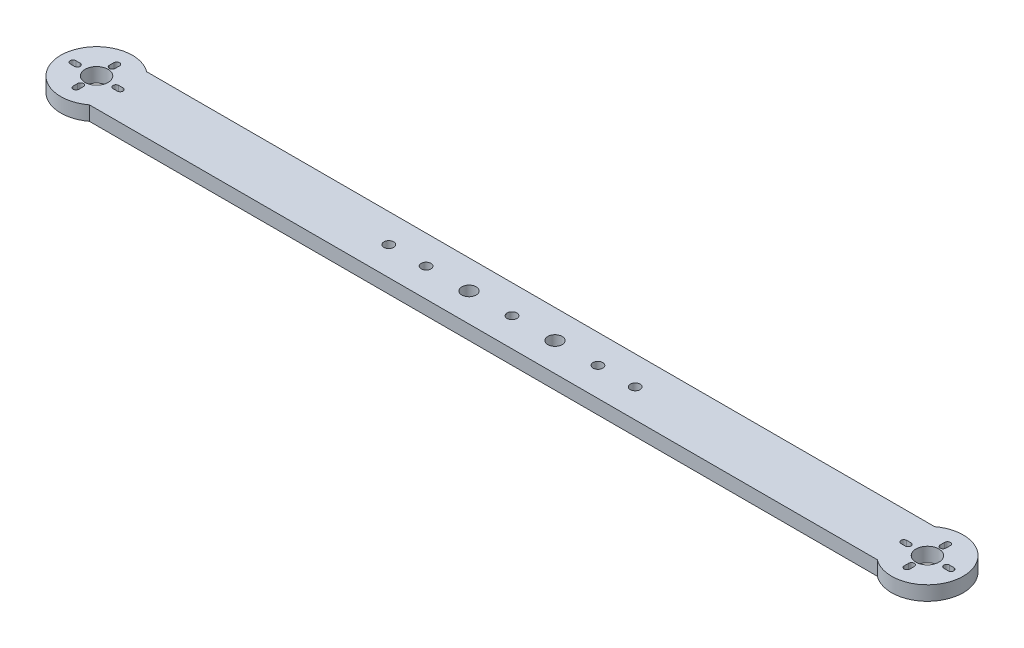
from build123d import *

# Parameters (mm, degrees)
BOSS_EXTRUDE1_DEPTH = 6.35
SKETCH2_R           = 5.08
CUT_EXTRUDE1_DEPTH  = 201.754423986
SKETCH3_R           = 2.159
CUT_EXTRUDE2_DEPTH  = 201.754423986
SKETCH4_R           = 3.175
CUT_EXTRUDE3_DEPTH  = 201.754423986
SKETCH6_R           = 2.159
CUT_EXTRUDE5_DEPTH  = 201.754423986


with BuildPart() as part:
    # Sketch1 → Boss-Extrude1 (new body)
    with BuildSketch(Plane(origin=(0, 0, 0), x_dir=(1, 0, 0), z_dir=(0, 1, 0))):
        with BuildLine():
            Line((-174.625, 12.7), (174.625, 12.7))
            ThreePointArc((174.625, 12.7), (200.025, 0), (174.625, -12.7))
            Line((174.625, -12.7), (-174.625, -12.7))
            ThreePointArc((-174.625, -12.7), (-200.025, 0), (-174.625, 12.7))
        make_face()
    extrude(amount=BOSS_EXTRUDE1_DEPTH)

    # Sketch2 → Cut-Extrude1 (cut, through all)
    with BuildSketch(Plane(origin=(0, 6.35, 0), x_dir=(1, 0, 0), z_dir=(0, 1, 0))):
        with Locations(Location((184.15, 0, 0), (0, 0, 270))):
            Circle(SKETCH2_R)
        with Locations(Location((-184.15, 0, 0), (0, 0, 90))):
            Circle(SKETCH2_R)
        with BuildLine():
            Line((173.691383345, 1.25), (175.608616655, 1.25))
            ThreePointArc((175.608616655, 1.25), (176.858616655, 0), (175.608616655, -1.25))
            Line((175.608616655, -1.25), (173.691383345, -1.25))
            ThreePointArc((173.691383345, -1.25), (172.441383345, 0), (173.691383345, 1.25))
        make_face()
        with BuildLine():
            Line((194.608616655, 1.25), (192.691383345, 1.25))
            ThreePointArc((192.691383345, 1.25), (191.441383345, 0), (192.691383345, -1.25))
            Line((192.691383345, -1.25), (194.608616655, -1.25))
            ThreePointArc((194.608616655, -1.25), (195.858616655, 0), (194.608616655, 1.25))
        make_face()
        with BuildLine():
            Line((185.4, 8.920928665), (185.4, 6.921035691))
            ThreePointArc((185.4, 6.921035691), (184.15, 5.671035691), (182.9, 6.921035691))
            Line((182.9, 6.921035691), (182.9, 8.920928665))
            ThreePointArc((182.9, 8.920928665), (184.15, 10.170928665), (185.4, 8.920928665))
        make_face()
        with BuildLine():
            Line((185.441381345, -9.078964309), (185.441381345, -7.078964309))
            ThreePointArc((185.441381345, -7.078964309), (184.191381345, -5.828964309), (182.941381345, -7.078964309))
            Line((182.941381345, -7.078964309), (182.941381345, -9.078964309))
            ThreePointArc((182.941381345, -9.078964309), (184.191381345, -10.328964309), (185.441381345, -9.078964309))
        make_face()
        with BuildLine():
            Line((-185.441381345, -9.078964309), (-185.441381345, -7.078964309))
            ThreePointArc((-185.441381345, -7.078964309), (-184.191381345, -5.828964309), (-182.941381345, -7.078964309))
            Line((-182.941381345, -7.078964309), (-182.941381345, -9.078964309))
            ThreePointArc((-182.941381345, -9.078964309), (-184.191381345, -10.328964309), (-185.441381345, -9.078964309))
        make_face()
        with BuildLine():
            Line((-185.4, 8.920928665), (-185.4, 6.921035691))
            ThreePointArc((-185.4, 6.921035691), (-184.15, 5.671035691), (-182.9, 6.921035691))
            Line((-182.9, 6.921035691), (-182.9, 8.920928665))
            ThreePointArc((-182.9, 8.920928665), (-184.15, 10.170928665), (-185.4, 8.920928665))
        make_face()
        with BuildLine():
            Line((-194.608616655, 1.25), (-192.691383345, 1.25))
            ThreePointArc((-192.691383345, 1.25), (-191.441383345, 0), (-192.691383345, -1.25))
            Line((-192.691383345, -1.25), (-194.608616655, -1.25))
            ThreePointArc((-194.608616655, -1.25), (-195.858616655, 0), (-194.608616655, 1.25))
        make_face()
        with BuildLine():
            Line((-173.691383345, 1.25), (-175.608616655, 1.25))
            ThreePointArc((-175.608616655, 1.25), (-176.858616655, 0), (-175.608616655, -1.25))
            Line((-175.608616655, -1.25), (-173.691383345, -1.25))
            ThreePointArc((-173.691383345, -1.25), (-172.441383345, 0), (-173.691383345, 1.25))
        make_face()
    extrude(amount=-CUT_EXTRUDE1_DEPTH, mode=Mode.SUBTRACT)

    # Sketch3 → Cut-Extrude2 (cut, through all)
    with BuildSketch(Plane(origin=(0, 6.35, 0), x_dir=(1, 0, 0), z_dir=(0, 1, 0))):
        with Locations(Location((0, 0, 0), (0, 0, 270))):
            Circle(SKETCH3_R)
        with Locations(Location((38.1, 0, 0), (0, 0, 270))):
            Circle(SKETCH3_R)
        with Locations(Location((-38.1, 0, 0), (0, 0, 270))):
            Circle(SKETCH3_R)
    extrude(amount=-CUT_EXTRUDE2_DEPTH, mode=Mode.SUBTRACT)

    # Sketch4 → Cut-Extrude3 (cut, through all)
    with BuildSketch(Plane(origin=(0, 6.35, 0), x_dir=(1, 0, 0), z_dir=(0, 1, 0))):
        with Locations(Location((-19.05, 0, 0), (0, 0, 270))):
            Circle(SKETCH4_R)
        with Locations(Location((19.05, 0, 0), (0, 0, 270))):
            Circle(SKETCH4_R)
    extrude(amount=-CUT_EXTRUDE3_DEPTH, mode=Mode.SUBTRACT)

    # Sketch6 → Cut-Extrude5 (cut, through all)
    with BuildSketch(Plane(origin=(0, 0, 0), x_dir=(-1, 0, 0), z_dir=(0, -1, 0))):
        with Locations(Location((54.61, 1.2e-08, 0), (0, 0, 90))):
            Circle(SKETCH6_R)
        with Locations(Location((-54.61, 0, 0), (0, 0, 90))):
            Circle(SKETCH6_R)
    extrude(amount=-CUT_EXTRUDE5_DEPTH, mode=Mode.SUBTRACT)


solid = part.part
